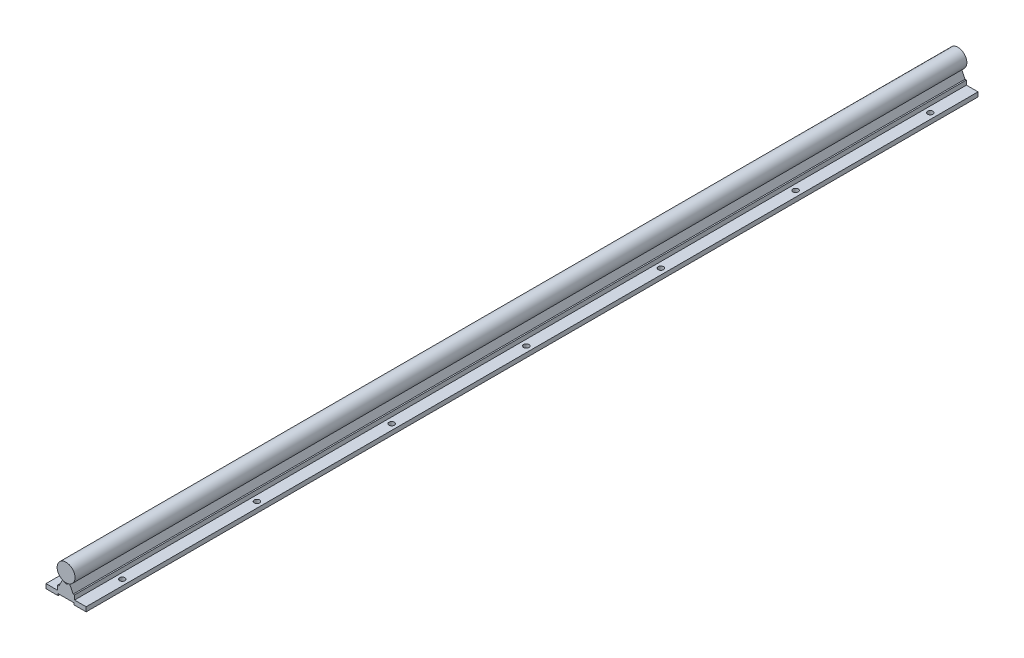
from build123d import *

# Parameters (mm, degrees)
SKETCH1_R             = 10
BOSS_EXTRUDE1_DEPTH   = 1000
BOSS_EXTRUDE1_2_DEPTH = 1000
SKETCH2_R             = 3
CUT_EXTRUDE1_DEPTH    = 1000


with BuildPart() as part:
    # Sketch1 → Boss-Extrude1 (new body)
    with BuildSketch(Plane.XY):
        Circle(SKETCH1_R)
    extrude(amount=-BOSS_EXTRUDE1_DEPTH)


with BuildPart() as body_2:
    # Sketch1 → Boss-Extrude1 2 (new body)
    with BuildSketch(Plane.XY):
        Polygon((-22.5, -27), (-9, -27), (-9, -25), (9, -25), (9, -27), (22.5, -27), (22.5, -22), (9.5, -22), (9.5, -17), (8, -17), (4, -9.16515139), (0, -11), (-4, -9.16515139), (-8, -17), (-9.5, -17), (-9.5, -22), (-22.5, -22), align=None)
    extrude(amount=-BOSS_EXTRUDE1_2_DEPTH)

    # Sketch2 → Cut-Extrude1 (cut)
    with BuildSketch(Plane(origin=(0, -22, 0), x_dir=(1, 0, 0), z_dir=(0, 1, 0))):
        with Locations(Location((16, 47, 0), (0, 0, 180))):
            Circle(SKETCH2_R)
        with Locations(Location((16, 198, 0), (0, 0, 180))):
            Circle(SKETCH2_R)
        with Locations(Location((16, 349, 0), (0, 0, 180))):
            Circle(SKETCH2_R)
        with Locations(Location((16, 500, 0), (0, 0, 180))):
            Circle(SKETCH2_R)
        with Locations(Location((16, 651, 0), (0, 0, 180))):
            Circle(SKETCH2_R)
        with Locations(Location((16, 802, 0), (0, 0, 180))):
            Circle(SKETCH2_R)
        with Locations(Location((16, 953, 0), (0, 0, 180))):
            Circle(SKETCH2_R)
    cut_extrude1 = extrude(amount=-CUT_EXTRUDE1_DEPTH, mode=Mode.SUBTRACT)

    # Mirror1: Cut-Extrude1 across plane
    add(cut_extrude1.mirror(Plane(origin=(0, 0, 0), x_dir=(0, 0, 1), z_dir=(1, 0, 0))), mode=Mode.SUBTRACT)


solid = Compound([part.part, body_2.part])
